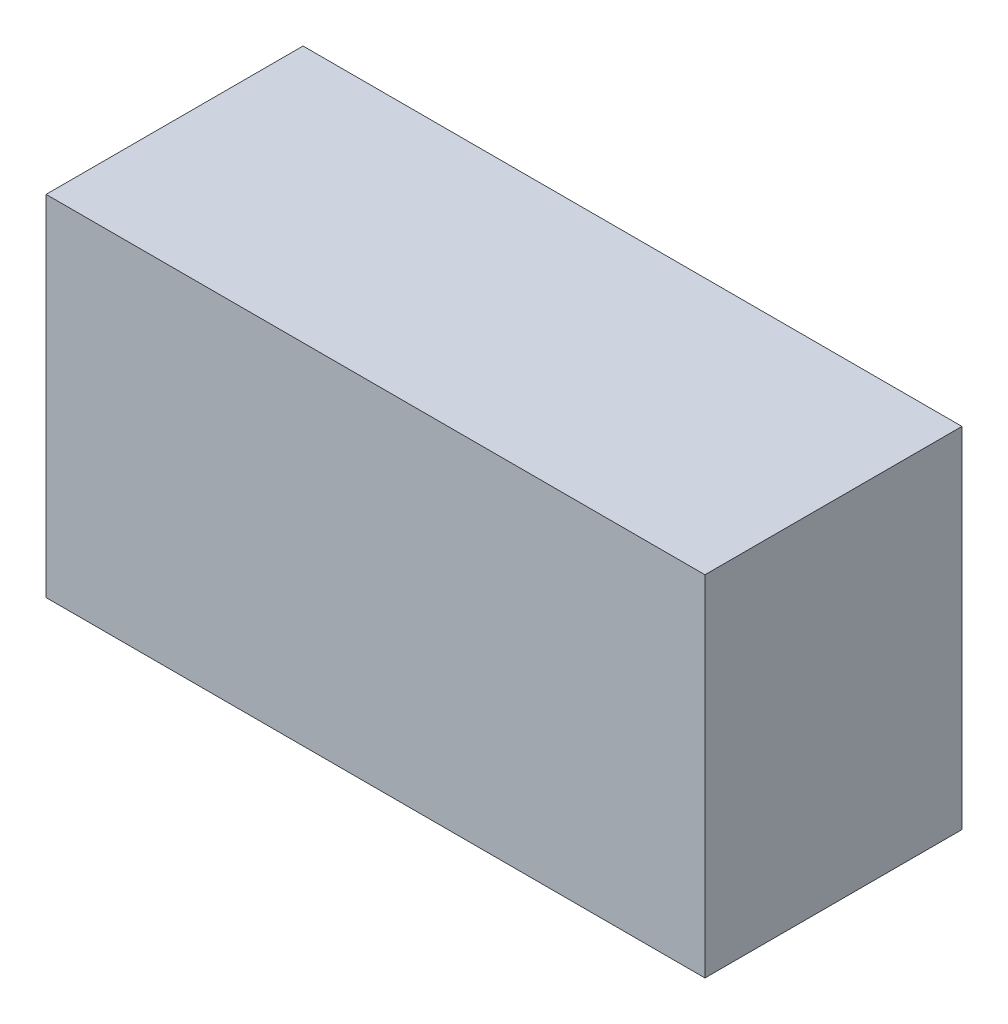
from build123d import *

# Parameters (mm, degrees)
SKETCH_1_W      = 100
SKETCH_1_H      = 39
EXTRUDE_1_DEPTH = 53


with BuildPart() as part:
    # 草图1 → 凸台-拉伸1 (new body)
    with BuildSketch(Plane(origin=(0, 0, 0), x_dir=(1, 0, 0), z_dir=(0, 1, 0))):
        with Locations((50, -19.5)):
            Rectangle(SKETCH_1_W, SKETCH_1_H)
    extrude(amount=EXTRUDE_1_DEPTH)


solid = part.part
